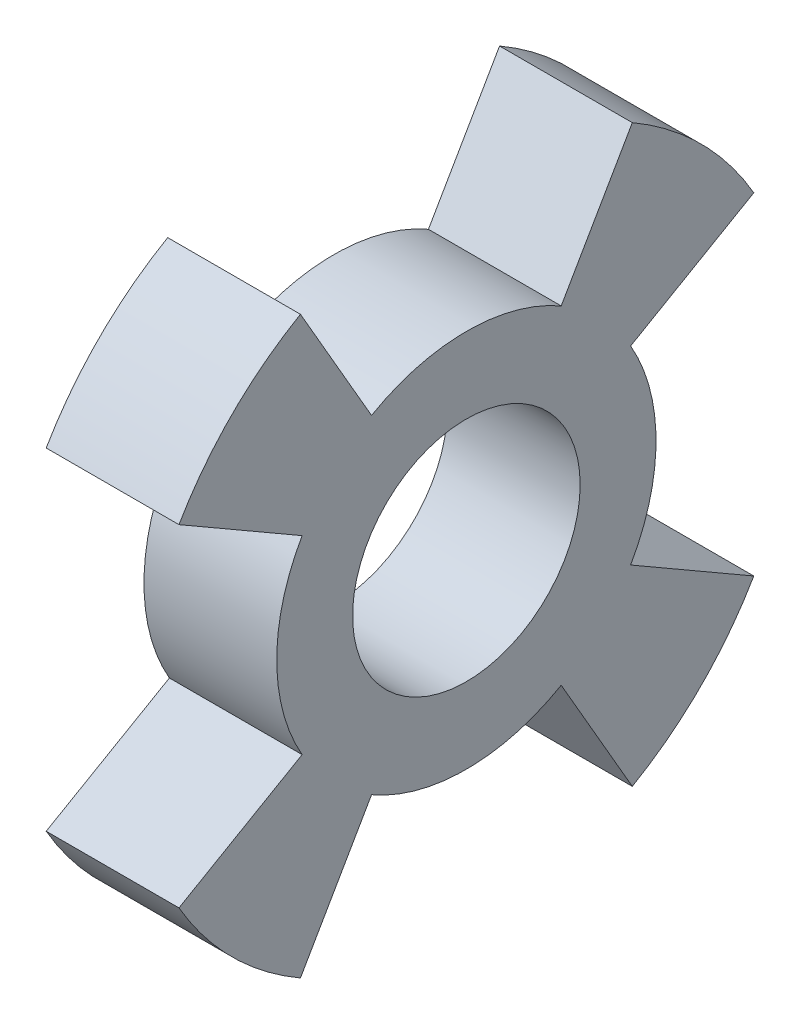
from build123d import *

# Parameters (mm, degrees)
SKETCH1_R               = 35
BOSS_EXTRUDE1_DEPTH     = 14
CUT_EXTRUDE1_DEPTH      = 52.439284598
CUT_EXTRUDE2_DEPTH      = 46.094345544
CUT_EXTRUDE2_DEPTH_BACK = 46.094345544
SKETCH3_R               = 12


with BuildPart() as part:
    # Sketch1 → Boss-Extrude1 (new body)
    with BuildSketch(Plane(origin=(0, 0, 0), x_dir=(0, 0, -1), z_dir=(1, 0, 0))):
        Circle(SKETCH1_R)
    extrude(amount=BOSS_EXTRUDE1_DEPTH)

    # Sketch2 → Cut-Extrude1 (cut, through all)
    with BuildSketch(Plane(origin=(0, 0, 0), x_dir=(0, 0, -1), z_dir=(1, 0, 0))):
        with BuildLine():
            Line((-17.5, 30.310889132), (-10, 17.320508076))
            ThreePointArc((-10, 17.320508076), (0, 20), (10, 17.320508076))
            Line((10, 17.320508076), (17.5, 30.310889132))
            ThreePointArc((17.5, 30.310889132), (0, 35), (-17.5, 30.310889132))
        make_face()
        with BuildLine():
            Line((30.310889132, 17.5), (17.320508076, 10))
            ThreePointArc((17.320508076, 10), (20, 0), (17.320508076, -10))
            Line((17.320508076, -10), (30.310889132, -17.5))
            ThreePointArc((30.310889132, -17.5), (35, 0), (30.310889132, 17.5))
        make_face()
        with BuildLine():
            Line((17.5, -30.310889132), (10, -17.320508076))
            ThreePointArc((10, -17.320508076), (0, -20), (-10, -17.320508076))
            Line((-10, -17.320508076), (-17.5, -30.310889132))
            ThreePointArc((-17.5, -30.310889132), (0, -35), (17.5, -30.310889132))
        make_face()
        with BuildLine():
            Line((-30.310889132, -17.5), (-17.320508076, -10))
            ThreePointArc((-17.320508076, -10), (-20, 0), (-17.320508076, 10))
            Line((-17.320508076, 10), (-30.310889132, 17.5))
            ThreePointArc((-30.310889132, 17.5), (-35, 0), (-30.310889132, -17.5))
        make_face()
    extrude(amount=CUT_EXTRUDE1_DEPTH, mode=Mode.SUBTRACT)

    # Sketch3 → Cut-Extrude2 (cut, two sides: drawn at the far end of the back side and taken through both)
    with BuildSketch(Plane(origin=(0, 0, 0), x_dir=(0, 0, -1), z_dir=(1, 0, 0)).offset(-CUT_EXTRUDE2_DEPTH_BACK)):
        Circle(SKETCH3_R)
    extrude(amount=CUT_EXTRUDE2_DEPTH + CUT_EXTRUDE2_DEPTH_BACK, mode=Mode.SUBTRACT)


solid = part.part
